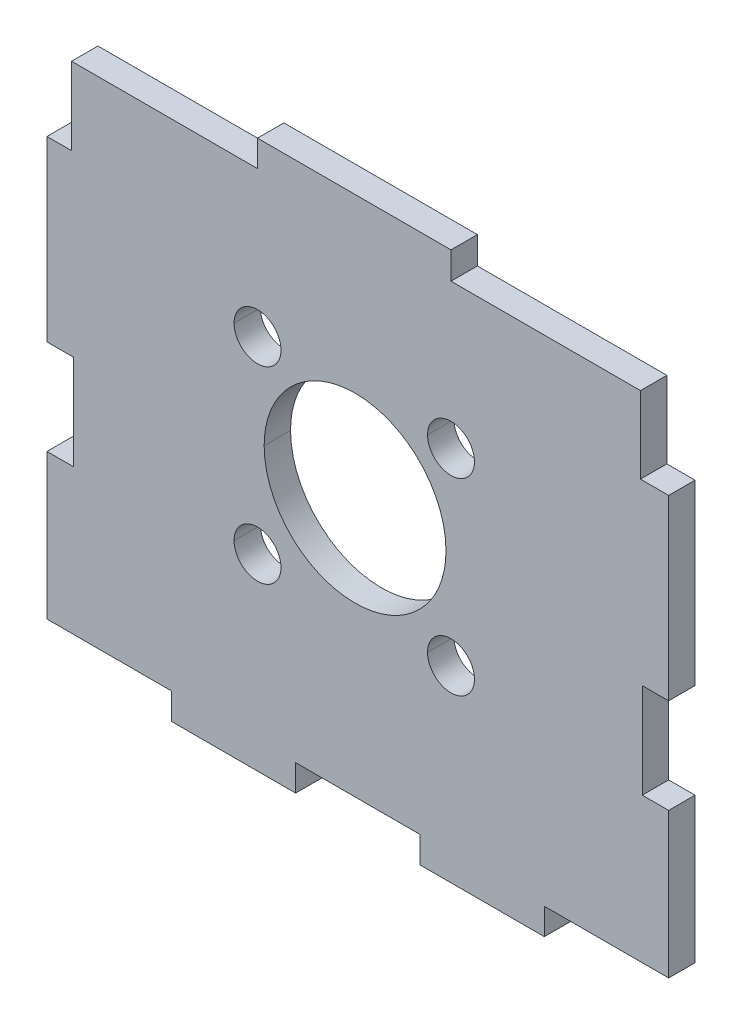
from build123d import *

# Parameters (mm, degrees)
BOSS_EXTRUDE1_DEPTH = 4.5


with BuildPart() as part:
    # Model → Boss-Extrude1 (new body)
    with BuildSketch(Plane.XY):
        with BuildLine():
            Line((1362.839116326, -825.001665905), (1341.639041609, -825.001665905))
            Line((1341.639041609, -825.001665905), (1341.639041609, -829.501663959))
            Line((1341.639041609, -829.501663959), (1320.439284392, -829.501663959))
            Line((1320.439284392, -829.501663959), (1320.439284392, -825.001665905))
            Line((1320.439284392, -825.001665905), (1299.238856897, -825.001665905))
            Line((1299.238856897, -825.001665905), (1299.238856897, -829.501663959))
            Line((1299.238856897, -829.501663959), (1278.039134958, -829.501663959))
            Line((1278.039134958, -829.501663959), (1278.039134958, -825.001665905))
            Line((1278.039134958, -825.001665905), (1256.839060241, -825.001665905))
            Line((1256.839060241, -825.001665905), (1256.839060241, -800.2517648))
            Line((1256.839060241, -800.2517648), (1261.339023018, -800.2517648))
            Line((1261.339023018, -800.2517648), (1261.339023018, -784.076339248))
            Line((1261.339023018, -784.076339248), (1256.839060241, -784.077715082))
            Line((1256.839060241, -784.077715082), (1256.839060241, -753.742283423))
            Line((1256.839060241, -753.742283423), (1261.032423851, -753.742283423))
            Line((1261.032423851, -753.742283423), (1261.032423851, -740.537740648))
            Line((1261.032423851, -740.537740648), (1292.737973843, -740.537740648))
            Line((1292.737973843, -740.537740648), (1292.737973843, -736.037777872))
            Line((1292.737973843, -736.037777872), (1325.727176335, -736.037777872))
            Line((1325.727176335, -736.037777872), (1325.727176335, -740.667457037))
            add(Edge.make_bspline(
                [(1325.727176335, -740.667457037), (1344.550481331, -740.667457037), (1358.032519105, -740.667457037)],
                knots=[0, 0, 0, 1, 1, 1], degree=2))
            Line((1358.032519105, -740.667457037), (1358.032519105, -753.742283423))
            Line((1358.032519105, -753.742283423), (1362.839116326, -753.742283423))
            Line((1362.839116326, -753.742283423), (1362.839116326, -784.076339248))
            Line((1362.839116326, -784.076339248), (1358.339153549, -784.076339248))
            Line((1358.339153549, -784.076339248), (1358.339153549, -800.2517648))
            Line((1358.339153549, -800.2517648), (1362.839116326, -800.2517648))
            Line((1362.839116326, -800.2517648), (1362.839116326, -825.001665905))
        make_face()
        with BuildLine():
            add(Edge.make_bspline(
                [(1293.873494954, -780.876362583), (1293.873494954, -772.315645362), (1300.812245786, -765.376188975), (1309.373315784, -765.376188975), (1317.933680226, -765.376188975), (1324.873489391, -772.315645362), (1324.873489391, -780.876362583)],
                knots=[2, 2, 2, 2, 3, 3, 3, 4, 4, 4, 4], degree=3))
            add(Edge.make_bspline(
                [(1324.873489391, -780.876362583), (1324.873489391, -789.436550636), (1317.933680226, -796.376183412), (1309.373315784, -796.376183412), (1300.812245786, -796.376183412), (1293.873494954, -789.436550636), (1293.873494954, -780.876362583)],
                knots=[0, 0, 0, 0, 1, 1, 1, 2, 2, 2, 2], degree=3))
        make_face(mode=Mode.SUBTRACT)
        with BuildLine():
            add(Edge.make_bspline(
                [(1321.72741717, -797.456918134), (1321.72741717, -795.247223968), (1323.518540502, -793.456488691), (1325.727529113, -793.456488691), (1327.936517724, -793.456488691), (1329.727288279, -795.247223968), (1329.727288279, -797.456918134)],
                knots=[2, 2, 2, 2, 3, 3, 3, 4, 4, 4, 4], degree=3))
            add(Edge.make_bspline(
                [(1329.727288279, -797.456918134), (1329.727288279, -799.665906745), (1327.936517724, -801.4566773), (1325.727529113, -801.4566773), (1323.518540502, -801.4566773), (1321.72741717, -799.665906745), (1321.72741717, -797.456918134)],
                knots=[0, 0, 0, 0, 1, 1, 1, 2, 2, 2, 2], degree=3))
        make_face(mode=Mode.SUBTRACT)
        with BuildLine():
            add(Edge.make_bspline(
                [(1321.72741717, -765.354140364), (1321.72741717, -763.144446198), (1323.518540502, -761.353710921), (1325.727529113, -761.353710921), (1327.936517724, -761.353710921), (1329.727288279, -763.144446198), (1329.727288279, -765.354140364)],
                knots=[2, 2, 2, 2, 3, 3, 3, 4, 4, 4, 4], degree=3))
            add(Edge.make_bspline(
                [(1329.727288279, -765.354140364), (1329.727288279, -767.563128975), (1327.936517724, -769.35389953), (1325.727529113, -769.35389953), (1323.518540502, -769.35389953), (1321.72741717, -767.563128975), (1321.72741717, -765.354140364)],
                knots=[0, 0, 0, 0, 1, 1, 1, 2, 2, 2, 2], degree=3))
        make_face(mode=Mode.SUBTRACT)
        with BuildLine():
            add(Edge.make_bspline(
                [(1288.738214678, -765.354140364), (1288.738214678, -763.144446198), (1290.528985233, -761.353710921), (1292.738326621, -761.353710921), (1294.947315232, -761.353710921), (1296.738403287, -763.144446198), (1296.738403287, -765.354140364)],
                knots=[2, 2, 2, 2, 3, 3, 3, 4, 4, 4, 4], degree=3))
            add(Edge.make_bspline(
                [(1296.738403287, -765.354140364), (1296.738403287, -767.563128975), (1294.947315232, -769.35389953), (1292.738326621, -769.35389953), (1290.528985233, -769.35389953), (1288.738214678, -767.563128975), (1288.738214678, -765.354140364)],
                knots=[0, 0, 0, 0, 1, 1, 1, 2, 2, 2, 2], degree=3))
        make_face(mode=Mode.SUBTRACT)
        with BuildLine():
            add(Edge.make_bspline(
                [(1288.738214678, -797.456918134), (1288.738214678, -795.247223968), (1290.528985233, -793.456488691), (1292.738326621, -793.456488691), (1294.947315232, -793.456488691), (1296.738403287, -795.247223968), (1296.738403287, -797.456918134)],
                knots=[2, 2, 2, 2, 3, 3, 3, 4, 4, 4, 4], degree=3))
            add(Edge.make_bspline(
                [(1296.738403287, -797.456918134), (1296.738403287, -799.665906745), (1294.947315232, -801.4566773), (1292.738326621, -801.4566773), (1290.528985233, -801.4566773), (1288.738214678, -799.665906745), (1288.738214678, -797.456918134)],
                knots=[0, 0, 0, 0, 1, 1, 1, 2, 2, 2, 2], degree=3))
        make_face(mode=Mode.SUBTRACT)
    extrude(amount=BOSS_EXTRUDE1_DEPTH)


solid = part.part
